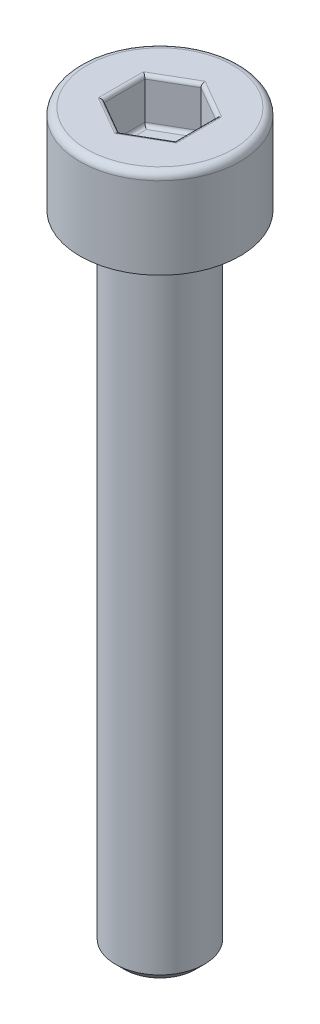
from build123d import *

# Parameters (mm, degrees)
CHAMFER1_SIZE      = 0.25
FILLET1_R          = 0.2
CUT_EXTRUDE1_DEPTH = 1.25
FILLET2_R          = 0.1


with BuildPart() as part:
    # Sketch1 → Revolve1 (revolve)
    with BuildSketch(Plane.XY, mode=Mode.PRIVATE) as revolve1_sk:
        Polygon((0, -20.5), (-1.25, -20.5), (-1.25, -2.5), (-2.25, -2.5), (-2.25, 0), (0, 0), align=None)
    revolve(revolve1_sk.sketch.rotate(Axis((0, 0, 0), (0, -1, 0)), 270), axis=Axis((0, 0, 0), (0, -1, 0)))

    # Chamfer1
    chamfer1_edges = [part.edges().sort_by_distance(p)[0] for p in [
        (0, -2.5, -1.25),
        (0, -20.5, -1.25),
    ]]
    chamfer(chamfer1_edges, length=CHAMFER1_SIZE)

    # Fillet1
    fillet1_edges = [part.edges().sort_by_distance(p)[0] for p in [
        (0, 0, -2.25),
    ]]
    fillet(fillet1_edges, radius=FILLET1_R)

    # Sketch2 → Cut-Extrude1 (cut)
    with BuildSketch(Plane(origin=(0, 0, 0), x_dir=(1, 0, 0), z_dir=(0, 1, 0))):
        Polygon((0, 1.154700538), (-1, 0.577350269), (-1, -0.577350269), (0, -1.154700538), (1, -0.577350269), (1, 0.577350269), align=None)
    extrude(amount=-CUT_EXTRUDE1_DEPTH, mode=Mode.SUBTRACT)

    # Fillet2
    fillet2_edges = [part.edges().sort_by_distance(p)[0] for p in [
        (0.5, -1.25, -0.866025404),
        (1, -1.25, 0),
        (0.5, -1.25, 0.866025404),
        (-0.5, -1.25, 0.866025404),
        (-1, -1.25, 0),
        (-0.5, -1.25, -0.866025404),
        (0.4999999999999987, 0, -0.8660254037844397),
        (-0.5000000000000006, 0, -0.8660254037844395),
        (-1, 0, 0),
        (-0.5000000000000007, 0, 0.8660254037844379),
        (0.4999999999999988, 0, 0.8660254037844382),
        (1, 0, 0),
    ]]
    fillet(fillet2_edges, radius=FILLET2_R)


solid = part.part
